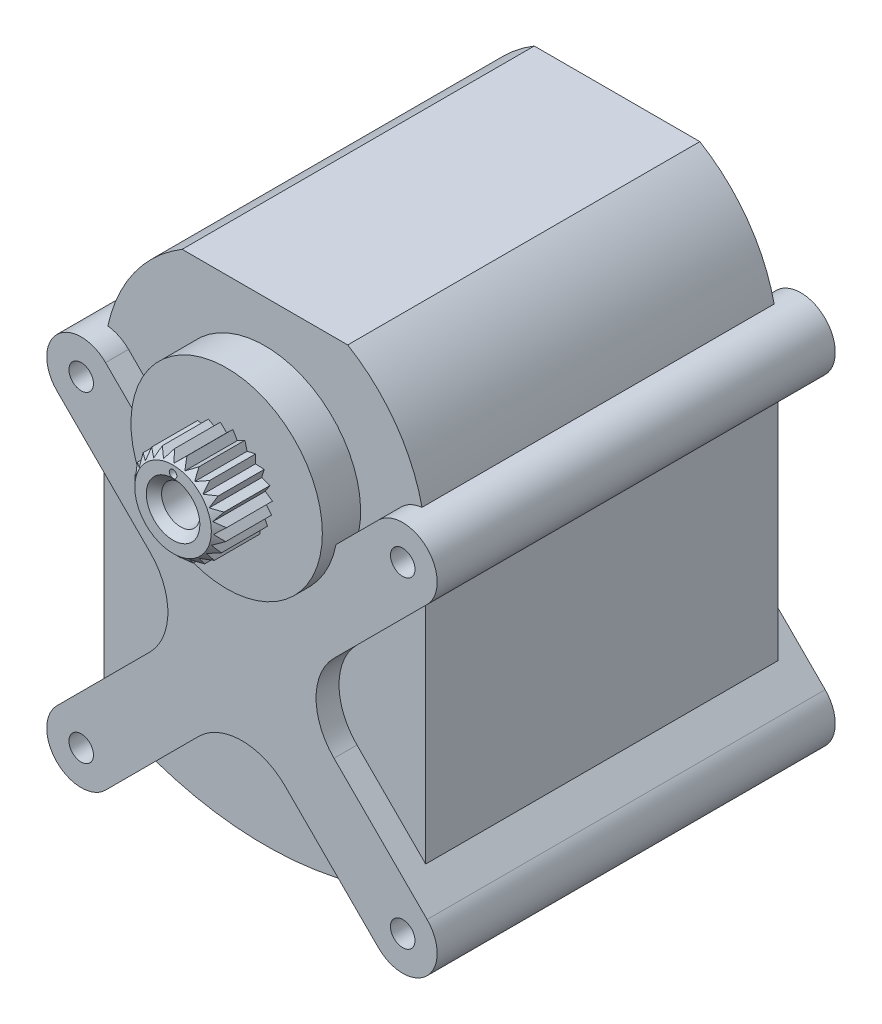
from build123d import *

# Parameters (mm, degrees)
EXTRUDE_1_DEPTH          = 11.5
SKETCH_2_R               = 6.25
EXTRUDE_2_DEPTH          = 14
SKETCH_3_R               = 3.5
EXTRUDE_3_DEPTH          = 2
CHAMFER_1_SIZE           = 0.5
M2_5X0_45_1_D            = 2.05
M2_5X0_45_1_DEPTH        = 7.25
M2_5X0_45_1_TIP          = 0.615882135
EXTRUDE_4_DEPTH          = 13
M2X0_4_1_D               = 1.6
PATTERN_CIRCULAR_1_COUNT = 4
FILLET_1_R               = 4
EXTRUDE_5_DEPTH          = 26
SKETCH_13_R              = 3
EXTRUDE_6_DEPTH          = 3.5
M3X0_5_1_D               = 2.5
M3X0_5_1_DEPTH           = 10
M3X0_5_1_TIP             = 0.751075774
CHAMFER_2_SIZE           = 0.5
SKETCH_17_R              = 0.25
CUT_EXTRUDE_1_DEPTH      = 0.5
CUT_EXTRUDE_2_REACH      = 44.724
PATTERN_CIRCULAR_2_COUNT = 23


with BuildPart() as part:
    # ｽｹｯﾁ1 → ﾎﾞｽ - 押し出し1 (new, symmetric)
    with BuildSketch(Plane.XY):
        with BuildLine():
            Line((-5.408326913, 9), (5.408326913, 9))
            ThreePointArc((5.408326913, 9), (9.138857494, 5.170230527), (10.5, 0))
            Line((10.5, 0), (10.5, -19.332614929))
            ThreePointArc((10.5, -19.332614929), (0, -22), (-10.5, -19.332614929))
            Line((-10.5, -19.332614929), (-10.5, 0))
            ThreePointArc((-10.5, 0), (-9.138857494, 5.170230527), (-5.408326913, 9))
        make_face()
    extrude(amount=EXTRUDE_1_DEPTH, both=True)

    # ｽｹｯﾁ2 → ﾎﾞｽ - 押し出し2 (add, symmetric)
    with BuildSketch(Plane.XY):
        Circle(SKETCH_2_R)
    extrude(amount=EXTRUDE_2_DEPTH, both=True)

    # ｽｹｯﾁ3 → ﾎﾞｽ - 押し出し3 (add)
    with BuildSketch(Plane(origin=(0, 0, -14), x_dir=(-1, 0, 0), z_dir=(0, 0, -1))):
        Circle(SKETCH_3_R)
    extrude(amount=EXTRUDE_3_DEPTH)

    # 面取り1
    chamfer_1_edges = [part.edges().sort_by_distance(p)[0] for p in [
        (3.5, 0, -16),
    ]]
    chamfer(chamfer_1_edges, length=CHAMFER_1_SIZE)

    # M2.5x0.45 ねじ穴1
    with Locations(Plane(origin=(0, 0, -16), x_dir=(-1, 0, 0), z_dir=(0, 0, -1))):
        with Locations((0, 0)):
            Hole(M2_5X0_45_1_D / 2, depth=M2_5X0_45_1_DEPTH)
            with Locations((0, 0, -(M2_5X0_45_1_DEPTH + M2_5X0_45_1_TIP / 2))):  # 118° drill point
                Cone(0, M2_5X0_45_1_D / 2, M2_5X0_45_1_TIP, mode=Mode.SUBTRACT)

    # ｽｹｯﾁ7 → ﾎﾞｽ - 押し出し4 (add, symmetric)
    with BuildSketch(Plane.XY):
        with BuildLine():
            Line((-12.090990258, -1.590990258), (-3.181980515, -10.5))
            Line((-3.181980515, -10.5), (0, -10.5))
            Line((0, -10.5), (0, -7.318019485))
            Line((0, -7.318019485), (-8.909009742, 1.590990258))
            ThreePointArc((-8.909009742, 1.590990258), (-12.090990258, 1.590990258), (-12.090990258, -1.590990258))
        make_face()
    extrude_4 = extrude(amount=EXTRUDE_4_DEPTH, both=True)

    # M2x0.4 ねじ穴1 (through all)
    with Locations(Plane.XY.offset(13)):
        with Locations((-10.5, 0)):
            m2x0_4_1 = Hole(M2X0_4_1_D / 2)

    # 円形ﾊﾟﾀｰﾝ1: ﾎﾞｽ - 押し出し4, M2x0.4 ねじ穴1 ×4 about axis
    pattern_circular_1_axis = Axis((0, -10.5, 0), (0, 0, 1))
    add([extrude_4.rotate(pattern_circular_1_axis, i * 360 / PATTERN_CIRCULAR_1_COUNT) for i in range(1, PATTERN_CIRCULAR_1_COUNT)])
    add([m2x0_4_1.rotate(pattern_circular_1_axis, i * 360 / PATTERN_CIRCULAR_1_COUNT) for i in range(1, PATTERN_CIRCULAR_1_COUNT)], mode=Mode.SUBTRACT)

    # ﾌｨﾚｯﾄ1
    fillet_1_edges = [part.edges().sort_by_distance(p)[0] for p in [
        (3.181980515, -10.5, -12.25),
        (3.181980515, -10.5, 12.25),
        (0, -13.681980515, -12.25),
        (0, -13.681980515, 12.25),
        (-3.181980515, -10.5, -12.25),
        (-3.181980515, -10.5, 12.25),
    ]]
    fillet(fillet_1_edges, radius=FILLET_1_R)

    # ｽｹｯﾁ12 → ﾎﾞｽ - 押し出し5 (add)
    with BuildSketch(Plane(origin=(0, 0, -13), x_dir=(-1, 0, 0), z_dir=(0, 0, -1))):
        Polygon((0, -7.318019485), (-1.180522763, -6.137496721), (1.180522763, -6.137496721), align=None)
    extrude(amount=-EXTRUDE_5_DEPTH)

    # ｽｹｯﾁ13 → ﾎﾞｽ - 押し出し6 (add)
    with BuildSketch(Plane.XY.offset(14)):
        Circle(SKETCH_13_R)
    extrude(amount=EXTRUDE_6_DEPTH)

    # M3x0.5 ねじ穴1
    with Locations(Plane.XY.offset(17.5)):
        with Locations((0, 0)):
            Hole(M3X0_5_1_D / 2, depth=M3X0_5_1_DEPTH)
            with Locations((0, 0, -(M3X0_5_1_DEPTH + M3X0_5_1_TIP / 2))):  # 118° drill point
                Cone(0, M3X0_5_1_D / 2, M3X0_5_1_TIP, mode=Mode.SUBTRACT)

    # 面取り2
    chamfer_2_edges = [part.edges().sort_by_distance(p)[0] for p in [
        (-3, 0, 17.5),
        (1.25, 0, 17.5),
    ]]
    chamfer(chamfer_2_edges, length=CHAMFER_2_SIZE)

    # ｽｹｯﾁ17 → ｶｯﾄ - 押し出し1 (cut)
    with BuildSketch(Plane.XY.offset(17.5)):
        with Locations((0, 2)):
            Circle(SKETCH_17_R)
    extrude(amount=-CUT_EXTRUDE_1_DEPTH, mode=Mode.SUBTRACT)

    # ｶｯﾄ - 押し出し2: up to this face of the body (flat: up to its plane)
    cut_extrude_2_end = Plane(part.part.faces().sort_by_distance((-6.073223305, 0, 14))[0])
    # ｽｹｯﾁ18 → ｶｯﾄ - 押し出し2 (cut, up to the picked face)
    with BuildSketch(Plane.XY.offset(17.5), mode=Mode.PRIVATE) as cut_extrude_2_sk1:
        with BuildLine():
            Line((0, 2.574530741), (-0.408499947, 2.972057838))
            Line((-0.408499947, 2.972057838), (-0.476583272, 3.467400811))
            ThreePointArc((-0.476583272, 3.467400811), (0, 3.5), (0.476583272, 3.467400811))
            Line((0.476583272, 3.467400811), (0.408499947, 2.972057838))
            Line((0.408499947, 2.972057838), (0, 2.574530741))
        make_face()
    cut_extrude_2_tool1 = split(extrude(cut_extrude_2_sk1.sketch, amount=-CUT_EXTRUDE_2_REACH, mode=Mode.PRIVATE), bisect_by=cut_extrude_2_end, keep=Keep.BOTH, mode=Mode.PRIVATE)
    cut_extrude_2 = cut_extrude_2_tool1.solids().sort_by(Axis((0, 3.133577, 17.5), (0, 0, -1)))[0]
    add(cut_extrude_2, mode=Mode.SUBTRACT)

    # 円形ﾊﾟﾀｰﾝ2: ｶｯﾄ - 押し出し2 ×23 about axis
    pattern_circular_2_axis = Axis((0, 0, 0), (0, 0, 1))
    for i in range(1, PATTERN_CIRCULAR_2_COUNT):
        add(cut_extrude_2.rotate(pattern_circular_2_axis, i * 360 / PATTERN_CIRCULAR_2_COUNT), mode=Mode.SUBTRACT)


solid = part.part
